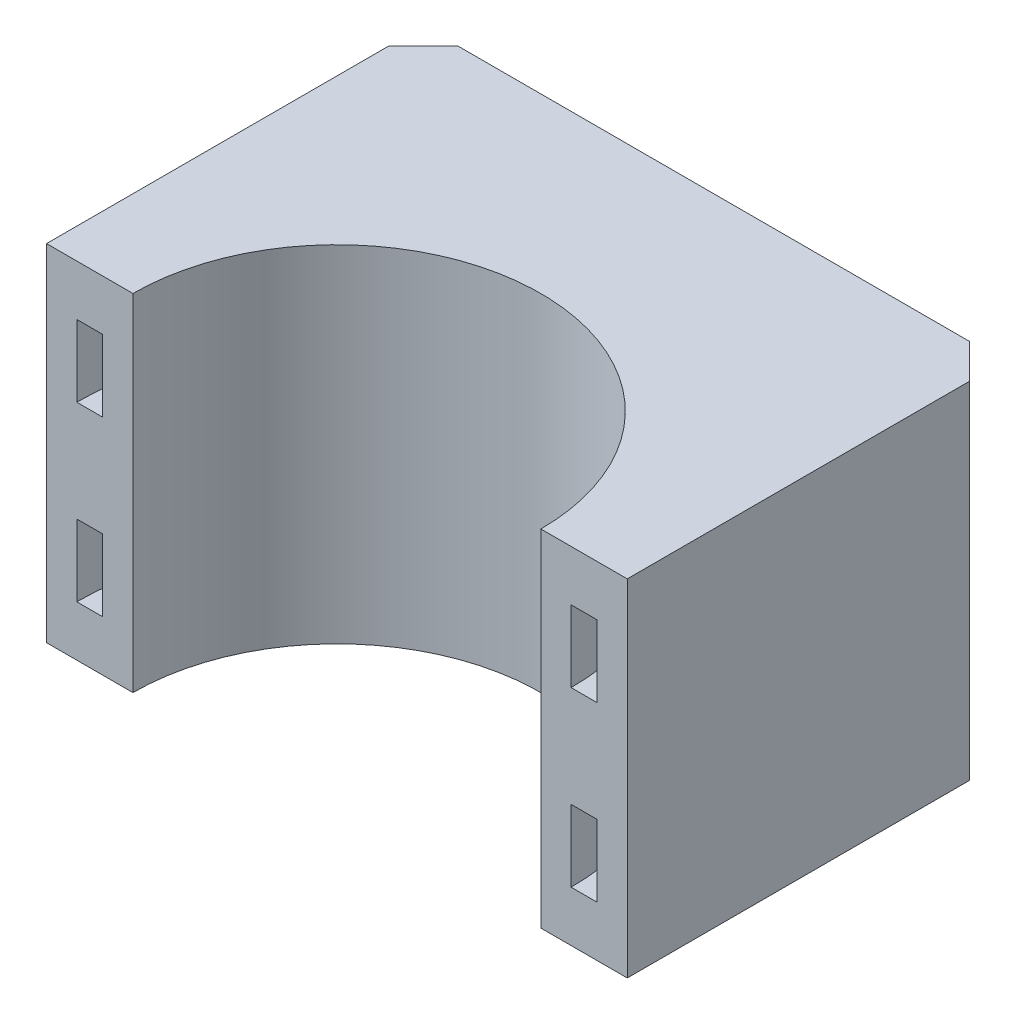
from build123d import *

# Parameters (mm, degrees)
BOSS_EXTRUDE1_DEPTH             = 10
SKETCH2_W                       = 1.5
SKETCH2_H                       = 4.15
TAP_DRILL_FOR_M3X0_5_TAP1_D     = 2.5
TAP_DRILL_FOR_M3X0_5_TAP1_DEPTH = 8.248924226
TAP_DRILL_FOR_M3X0_5_TAP1_TIP   = 0.751075774
CHAMFER1_SIZE                   = 2


with BuildPart() as part:
    # Sketch1 → Boss-Extrude1 (new, symmetric)
    with BuildSketch(Plane(origin=(0, 0, 0), x_dir=(1, 0, 0), z_dir=(0, 1, 0))):
        with BuildLine():
            Line((-11.8, 0), (-16.8, 0))
            Line((-16.8, 0), (-16.8, 21.8))
            Line((-16.8, 21.8), (16.8, 21.8))
            Line((16.8, 21.8), (16.8, 0))
            Line((16.8, 0), (11.8, 0))
            ThreePointArc((11.8, 0), (0, 11.8), (-11.8, 0))
        make_face()
    extrude(amount=BOSS_EXTRUDE1_DEPTH, both=True)

    # Sketch2 → Cut-Revolve1 (revolve, cut)
    with BuildSketch(Plane.XY):
        with Locations((14.3, 5)):
            Rectangle(SKETCH2_W, SKETCH2_H)
        with Locations((14.3, -5)):
            Rectangle(SKETCH2_W, SKETCH2_H)
    revolve(axis=Axis((0, 0, 0), (0, -1, 0)), mode=Mode.SUBTRACT)

    # Tap Drill for M3x0.5 Tap1
    with Locations(Plane(origin=(0, 0, -21.8), x_dir=(-1, 0, 0), z_dir=(0, 0, -1))):
        with Locations((0, 0), (11.8, -5), (11.8, 5), (-11.8, 5), (-11.8, -5)):
            Hole(TAP_DRILL_FOR_M3X0_5_TAP1_D / 2, depth=TAP_DRILL_FOR_M3X0_5_TAP1_DEPTH)
            with Locations((0, 0, -(TAP_DRILL_FOR_M3X0_5_TAP1_DEPTH + TAP_DRILL_FOR_M3X0_5_TAP1_TIP / 2))):  # 118° drill point
                Cone(0, TAP_DRILL_FOR_M3X0_5_TAP1_D / 2, TAP_DRILL_FOR_M3X0_5_TAP1_TIP, mode=Mode.SUBTRACT)

    # Chamfer1
    chamfer1_edges = [part.edges().sort_by_distance(p)[0] for p in [
        (-16.8, 0, -21.8),
        (16.8, 0, -21.8),
    ]]
    chamfer(chamfer1_edges, length=CHAMFER1_SIZE)


solid = part.part
